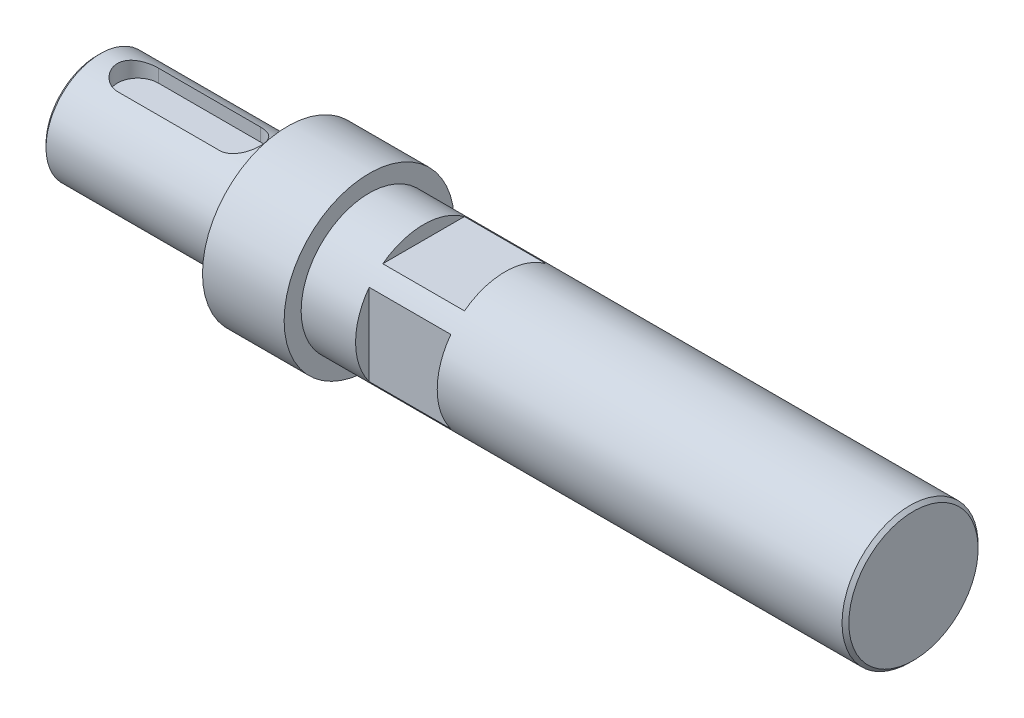
from build123d import *

# Parameters (mm, degrees)
SKETCH_2_OUTSIDE_W   = 102.04
SKETCH_2_OUTSIDE_H   = 102.04
SKETCH_2_OUTSIDE_W_2 = 32
SKETCH_2_OUTSIDE_H_2 = 32
CUT_EXTRUDE_1_DEPTH  = 24
CUT_EXTRUDE_2_DEPTH  = 5


with BuildPart() as part:
    # Эскиз1 → Повернуть1 (revolve)
    with BuildSketch(Plane.XY, mode=Mode.PRIVATE) as revolve_1_sk:
        Polygon((0, 0), (0, 19), (-1, 20), (-160, 20), (-160, 25), (-184, 25), (-184, 16), (-239, 16), (-240, 15), (-240, 0), align=None)
    revolve(revolve_1_sk.sketch.rotate(Axis((-178.322580645, 0, 0), (1, 0, 0)), 90), axis=Axis((-178.322580645, 0, 0), (1, 0, 0)))

    # Эскиз2 outside → Вырез-Вытянуть1 (cut)
    with BuildSketch(Plane(origin=(-144, 0, 0), x_dir=(0, 0, -1), z_dir=(1, 0, 0))):
        Rectangle(SKETCH_2_OUTSIDE_W, SKETCH_2_OUTSIDE_H)
        Rectangle(SKETCH_2_OUTSIDE_W_2, SKETCH_2_OUTSIDE_H_2, mode=Mode.SUBTRACT)
    extrude(amount=CUT_EXTRUDE_1_DEPTH, mode=Mode.SUBTRACT)

    # Эскиз3 → Вырез-Вытянуть2 (cut)
    with BuildSketch(Plane(origin=(0, 16, 0), x_dir=(1, 0, 0), z_dir=(0, 1, 0))):
        with BuildLine():
            Line((-228, 6), (-198, 6))
            ThreePointArc((-198, 6), (-192, 0), (-198, -6))
            Line((-198, -6), (-228, -6))
            ThreePointArc((-228, -6), (-234, 0), (-228, 6))
        make_face()
    extrude(amount=-CUT_EXTRUDE_2_DEPTH, mode=Mode.SUBTRACT)


solid = part.part
